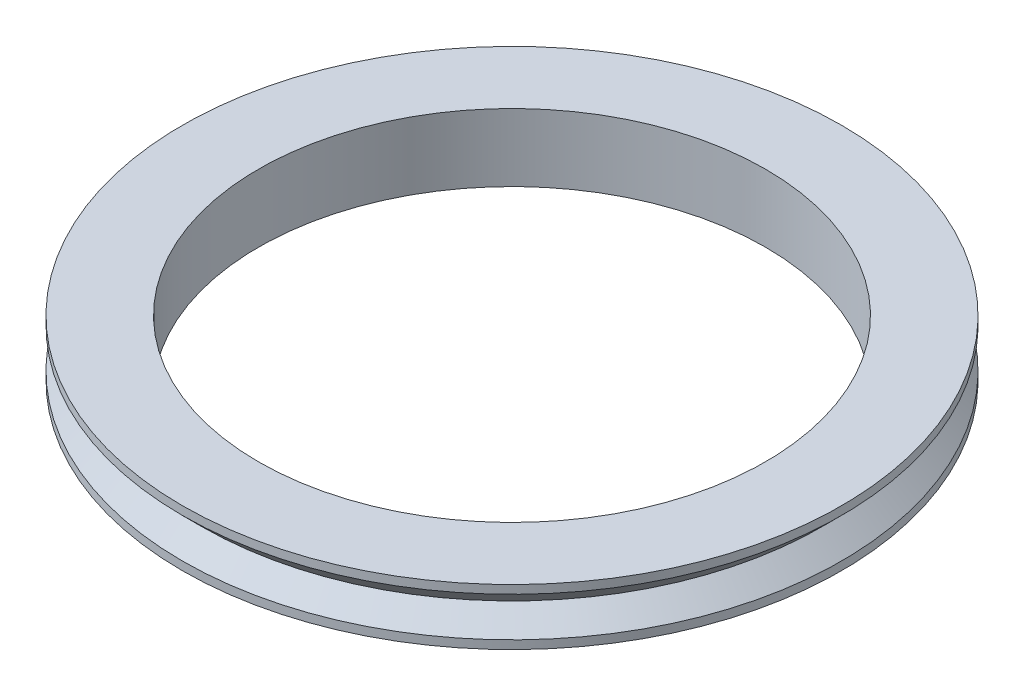
from build123d import *


with BuildPart() as part:
    # Esquisse1 → Révolution1 (revolve)
    with BuildSketch(Plane.XY, mode=Mode.PRIVATE) as r_volution1_sk:
        Polygon((22.5, 0), (24.5, 0), (24.5, 1), (29.25, 1), (29.25, 1.75), (27.5, 3.5), (29.25, 5.25), (29.25, 6), (22.5, 6), align=None)
    revolve(r_volution1_sk.sketch.rotate(Axis((0, 68.201523179, 0), (0, -1, 0)), 90), axis=Axis((0, 68.201523179, 0), (0, -1, 0)))


solid = part.part
